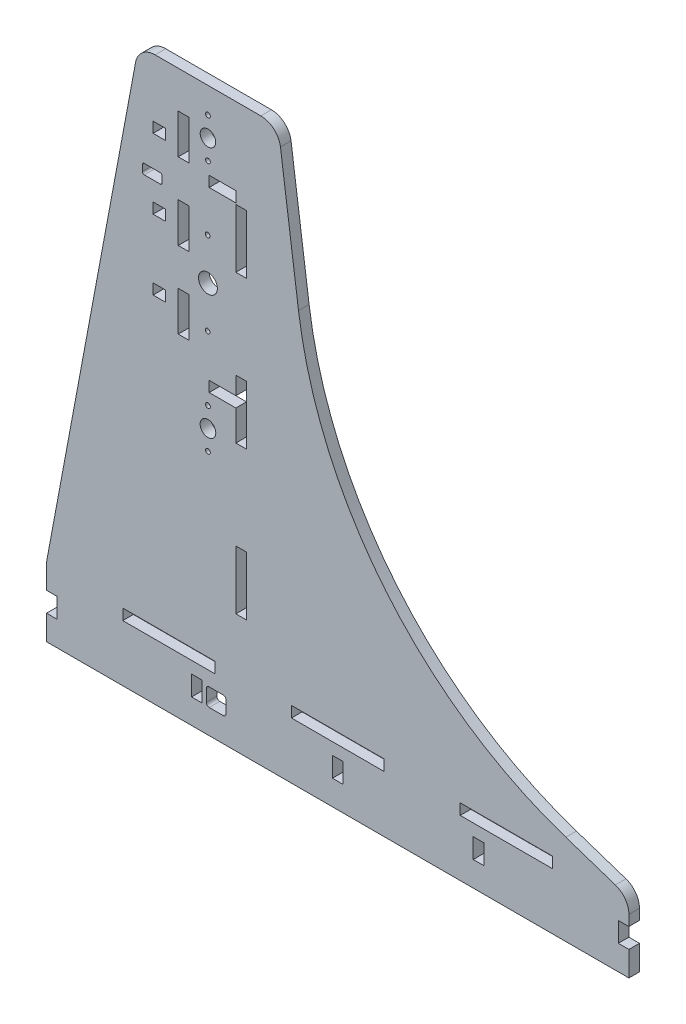
from build123d import *

# Parameters (mm, degrees)
MODEL_R             = 3.915
MODEL_R_2           = 3.95
MODEL_R_3           = 4.75
MODEL_R_4           = 1.2
MODEL_W             = 46.666666667
MODEL_H             = 5.5
MODEL_W_2           = 46.666666666
MODEL_W_3           = 5.35
MODEL_H_2           = 10
MODEL_H_3           = 20
MODEL_W_4           = 6.35
MODEL_H_4           = 5.35
MODEL_W_5           = 13.5
MODEL_H_5           = 29.666666667
BOSS_EXTRUDE1_DEPTH = 5.35


with BuildPart() as part:
    # Model → Boss-Extrude1 (new body)
    with BuildSketch(Plane.XY):
        with BuildLine():
            Line((44.976143444, 275.834551812), (0.169719249, 35.743360969))
            ThreePointArc((0.169719249, 35.743360969), (0.042520211, 34.830001994), (0, 33.908809156))
            Line((0, 33.908809156), (0, 22.5))
            Line((0, 22.5), (5.35, 22.5))
            Line((5.35, 22.5), (5.35, 12.5))
            Line((5.35, 12.5), (0, 12.5))
            Line((0, 12.5), (0, 0))
            Line((0, 0), (294, 0))
            Line((294, 0), (294, 12.5))
            Line((294, 12.5), (288.65, 12.5))
            Line((288.65, 12.5), (288.65, 22.5))
            Line((288.65, 22.5), (294, 22.5))
            Line((294, 22.5), (294, 27.7924078))
            ThreePointArc((294, 27.7924078), (292.112421852, 33.639510646), (287.16227766, 37.27924078))
            Line((287.16227766, 37.27924078), (262.140361786, 45.619879405))
            ThreePointArc((262.140361786, 45.619879405), (171.408861505, 107.720074789), (127.211688148, 208.394049963))
            Line((127.211688148, 208.394049963), (118.102287147, 275.348124452))
            ThreePointArc((118.102287147, 275.348124452), (114.770761961, 281.532637139), (108.193575805, 284))
            Line((108.193575805, 284), (54.806424195, 284))
            ThreePointArc((54.806424195, 284), (48.416804415, 281.692383185), (44.976143444, 275.834551812))
        make_face()
        with Locations((81.5, 261)):
            Circle(MODEL_R, mode=Mode.SUBTRACT)
        with Locations((81.5, 134)):
            Circle(MODEL_R_2, mode=Mode.SUBTRACT)
        with Locations((81.5, 197.5)):
            Circle(MODEL_R_3, mode=Mode.SUBTRACT)
        with Locations((81.5, 144)):
            Circle(MODEL_R_4, mode=Mode.SUBTRACT)
        with Locations((81.5, 124)):
            Circle(MODEL_R_4, mode=Mode.SUBTRACT)
        with Locations((81.5, 271)):
            Circle(MODEL_R_4, mode=Mode.SUBTRACT)
        with Locations((81.5, 251)):
            Circle(MODEL_R_4, mode=Mode.SUBTRACT)
        with Locations((81.34, 218.5)):
            Circle(MODEL_R_4, mode=Mode.SUBTRACT)
        with Locations((81.34, 176.5)):
            Circle(MODEL_R_4, mode=Mode.SUBTRACT)
        with Locations((232.166666667, 31.25)):
            Rectangle(MODEL_W, MODEL_H, mode=Mode.SUBTRACT)
        with Locations((147, 31.25)):
            Rectangle(MODEL_W_2, MODEL_H, mode=Mode.SUBTRACT)
        with Locations((61.833333334, 31.25)):
            Rectangle(MODEL_W, MODEL_H, mode=Mode.SUBTRACT)
        with Locations((218.078666667, 17.5)):
            Rectangle(MODEL_W_3, MODEL_H_2, mode=Mode.SUBTRACT)
        with Locations((147, 17.5)):
            Rectangle(MODEL_W_3, MODEL_H_2, mode=Mode.SUBTRACT)
        with Locations((75.921333333, 17.5)):
            Rectangle(MODEL_W_3, MODEL_H_2, mode=Mode.SUBTRACT)
        with Locations((69.175, 177.75)):
            Rectangle(MODEL_W_3, MODEL_H_3, mode=Mode.SUBTRACT)
        with Locations((56.975, 181.15)):
            Rectangle(MODEL_W_4, MODEL_H_4, mode=Mode.SUBTRACT)
        with Locations((56.975, 216.5)):
            Rectangle(MODEL_W_4, MODEL_H_4, mode=Mode.SUBTRACT)
        with Locations((69.175, 216.5)):
            Rectangle(MODEL_W_3, MODEL_H_3, mode=Mode.SUBTRACT)
        with Locations((56.975, 251.85)):
            Rectangle(MODEL_W_4, MODEL_H_4, mode=Mode.SUBTRACT)
        with Locations((69.175, 255.25)):
            Rectangle(MODEL_W_3, MODEL_H_3, mode=Mode.SUBTRACT)
        with Locations((88.85, 242.325)):
            Rectangle(MODEL_W_5, MODEL_H_4, mode=Mode.SUBTRACT)
        with Locations((98.275, 74.833333334)):
            Rectangle(MODEL_W_3, MODEL_H_5, mode=Mode.SUBTRACT)
        with Locations((98.275, 224.166666667)):
            Rectangle(MODEL_W_3, MODEL_H_5, mode=Mode.SUBTRACT)
        Polygon((95.6, 164.333333333), (100.95, 164.333333333), (100.95, 134.666666667), (95.6, 134.666666667), (95.6, 150), (82.1, 150), (82.1, 155.35), (95.6, 155.35), align=None, mode=Mode.SUBTRACT)
        with BuildLine():
            Line((58.40524288, 229.800713661), (58.40524288, 232.800713661))
            ThreePointArc((58.40524288, 232.800713661), (58.112349661, 233.507820442), (57.40524288, 233.800713661))
            Line((57.40524288, 233.800713661), (49.40524288, 233.800713661))
            ThreePointArc((49.40524288, 233.800713661), (48.698136099, 233.507820442), (48.40524288, 232.800713661))
            Line((48.40524288, 232.800713661), (48.40524288, 229.800713661))
            ThreePointArc((48.40524288, 229.800713661), (48.698136099, 229.09360688), (49.40524288, 228.800713661))
            Line((49.40524288, 228.800713661), (57.40524288, 228.800713661))
            ThreePointArc((57.40524288, 228.800713661), (58.112349661, 229.09360688), (58.40524288, 229.800713661))
        make_face(mode=Mode.SUBTRACT)
        with BuildLine():
            Line((90.646444024, 13.83119442), (90.646444024, 19.83119442))
            ThreePointArc((90.646444024, 19.83119442), (90.207104196, 20.891854592), (89.146444024, 21.33119442))
            Line((89.146444024, 21.33119442), (82.146444024, 21.33119442))
            ThreePointArc((82.146444024, 21.33119442), (81.085783852, 20.891854592), (80.646444024, 19.83119442))
            Line((80.646444024, 19.83119442), (80.646444024, 13.83119442))
            ThreePointArc((80.646444024, 13.83119442), (81.085783852, 12.770534248), (82.146444024, 12.33119442))
            Line((82.146444024, 12.33119442), (89.146444024, 12.33119442))
            ThreePointArc((89.146444024, 12.33119442), (90.207104196, 12.770534248), (90.646444024, 13.83119442))
        make_face(mode=Mode.SUBTRACT)
    extrude(amount=BOSS_EXTRUDE1_DEPTH)


solid = part.part
